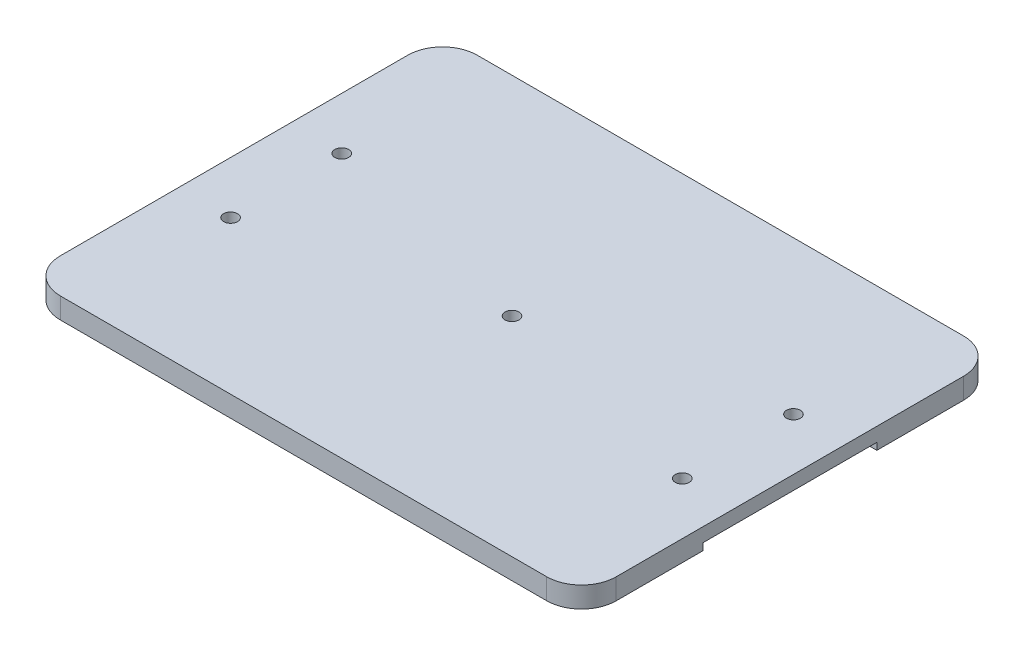
from build123d import *

# Parameters (mm, degrees)
SKETCH2_W           = 80
SKETCH2_H           = 60
BOSS_EXTRUDE1_DEPTH = 3
SKETCH3_W           = 15
SKETCH3_H           = 25
CUT_EXTRUDE1_DEPTH  = 1
SKETCH4_R           = 1
CUT_EXTRUDE3_DEPTH  = 2
FILLET1_R           = 5
SKETCH5_R           = 1
CUT_EXTRUDE4_DEPTH  = 3
SKETCH6_W           = 15
SKETCH6_H           = 25
CUT_EXTRUDE6_DEPTH  = 1
SKETCH7_R           = 1
CUT_EXTRUDE7_DEPTH  = 7


with BuildPart() as part:
    # Sketch2 → Boss-Extrude1 (new body)
    with BuildSketch(Plane(origin=(0, 0, 0), x_dir=(1, 0, 0), z_dir=(0, 1, 0))):
        with Locations((-19.25, -4.5)):
            Rectangle(SKETCH2_W, SKETCH2_H)
    extrude(amount=BOSS_EXTRUDE1_DEPTH)

    # Sketch3 → Cut-Extrude1 (cut)
    with BuildSketch(Plane.XZ):
        with Locations((-51.75, 4.5)):
            Rectangle(SKETCH3_W, SKETCH3_H)
    extrude(amount=-CUT_EXTRUDE1_DEPTH, mode=Mode.SUBTRACT)

    # Sketch4 → Cut-Extrude3 (cut)
    with BuildSketch(Plane.XZ.offset(-1)):
        with Locations(Location((-51.75, 12.5, 0), (0, 0, 270))):
            Circle(SKETCH4_R)
        with Locations(Location((-51.75, -3.5, 0), (0, 0, 270))):
            Circle(SKETCH4_R)
    extrude(amount=-CUT_EXTRUDE3_DEPTH, mode=Mode.SUBTRACT)

    # Fillet1
    fillet1_edges = [part.edges().sort_by_distance(p)[0] for p in [
        (-59.25, 1.5, -25.5),
        (20.75, 1.5, -25.5),
        (20.75, 1.5, 34.5),
        (-59.25, 1.5, 34.5),
    ]]
    fillet(fillet1_edges, radius=FILLET1_R)

    # Sketch5 → Cut-Extrude4 (cut)
    with BuildSketch(Plane.XZ):
        with Locations(Location((-19.25, 4.5, 0), (0, 0, 270))):
            Circle(SKETCH5_R)
    extrude(amount=-CUT_EXTRUDE4_DEPTH, mode=Mode.SUBTRACT)

    # Sketch6 → Cut-Extrude6 (cut)
    with BuildSketch(Plane(origin=(0, 0, 0), x_dir=(1, 0, 0), z_dir=(0, 1, 0))):
        with Locations((13.25, -4.5)):
            Rectangle(SKETCH6_W, SKETCH6_H)
    extrude(amount=CUT_EXTRUDE6_DEPTH, mode=Mode.SUBTRACT)

    # Sketch7 → Cut-Extrude7 (cut)
    with BuildSketch(Plane(origin=(0, 0, 0), x_dir=(1, 0, 0), z_dir=(0, 1, 0))):
        with Locations(Location((13.25, 3.5, 0), (0, 0, 90))):
            Circle(SKETCH7_R)
        with Locations(Location((13.25, -12.5, 0), (0, 0, 90))):
            Circle(SKETCH7_R)
    extrude(amount=CUT_EXTRUDE7_DEPTH, mode=Mode.SUBTRACT)


solid = part.part
